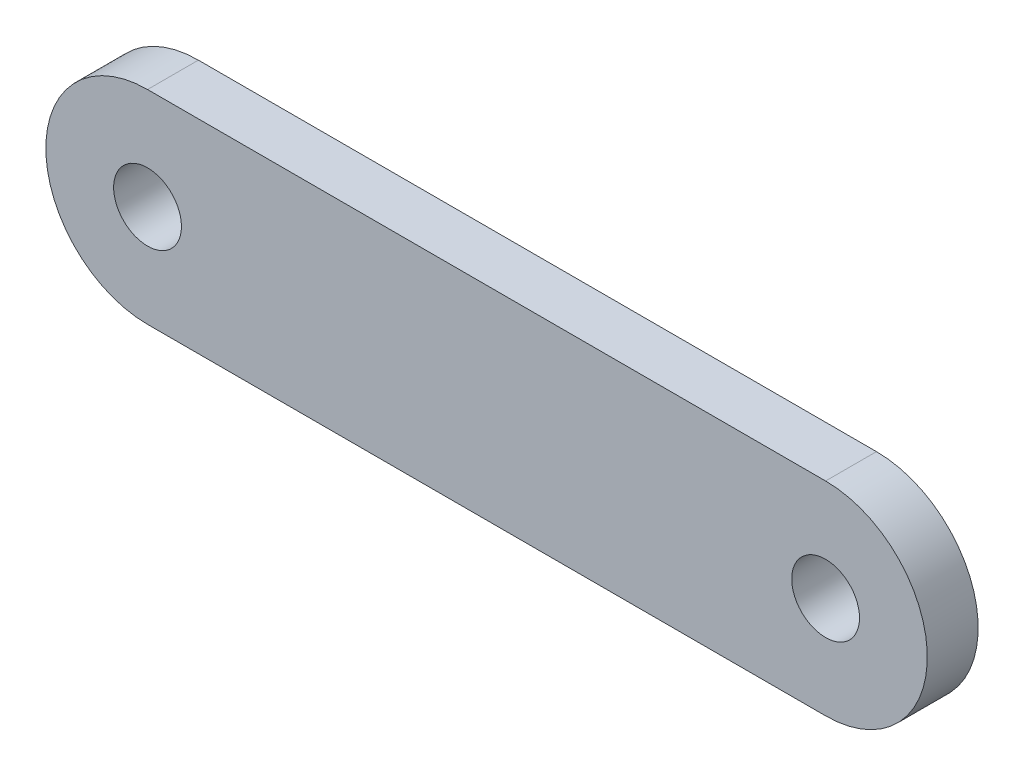
from build123d import *

# Parameters (mm, degrees)
SKETCH1_R           = 2
BOSS_EXTRUDE3_DEPTH = 3


with BuildPart() as part:
    # Sketch1 → Boss-Extrude3 (new body)
    with BuildSketch(Plane.XY):
        with BuildLine():
            Line((-35.312724167, 6), (4.687275833, 6))
            ThreePointArc((4.687275833, 6), (10.687275833, 0), (4.687275833, -6))
            Line((4.687275833, -6), (-35.312724167, -6))
            ThreePointArc((-35.312724167, -6), (-41.312724167, 0), (-35.312724167, 6))
        make_face()
        with Locations((-35.312724167, 0)):
            Circle(SKETCH1_R, mode=Mode.SUBTRACT)
        with Locations((4.687275833, 0)):
            Circle(SKETCH1_R, mode=Mode.SUBTRACT)
    extrude(amount=BOSS_EXTRUDE3_DEPTH)


solid = part.part
